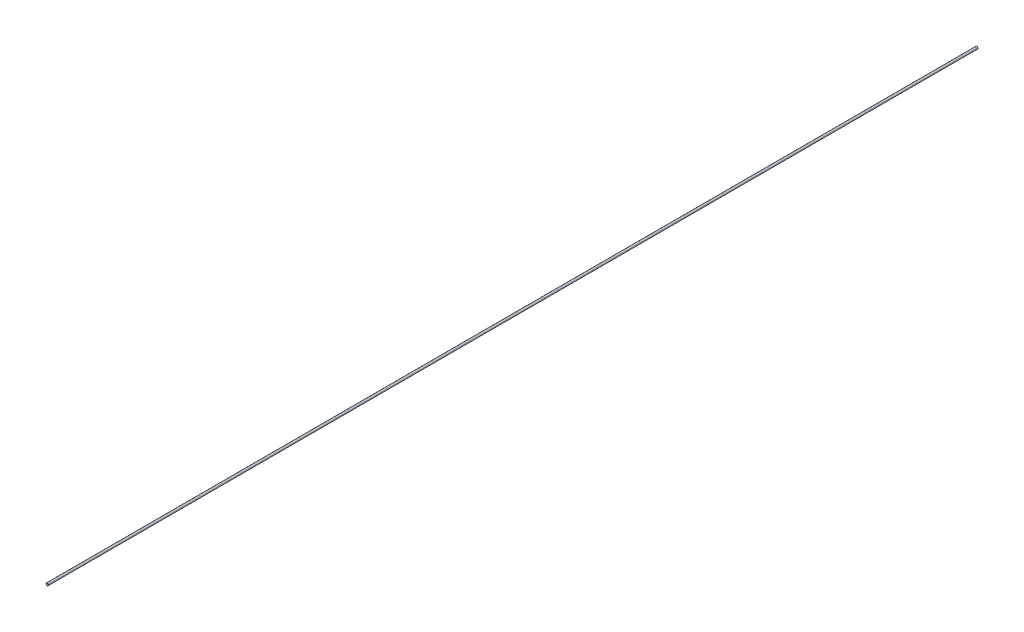
from build123d import *

# Parameters (mm, degrees)
SKETCH1_R           = 25.4
BOSS_EXTRUDE1_DEPTH = 20519.088017446


with BuildPart() as part:
    # Sketch1 → Boss-Extrude1 (new body)
    with BuildSketch(Plane.XY):
        Circle(SKETCH1_R)
    extrude(amount=-BOSS_EXTRUDE1_DEPTH)


solid = part.part
